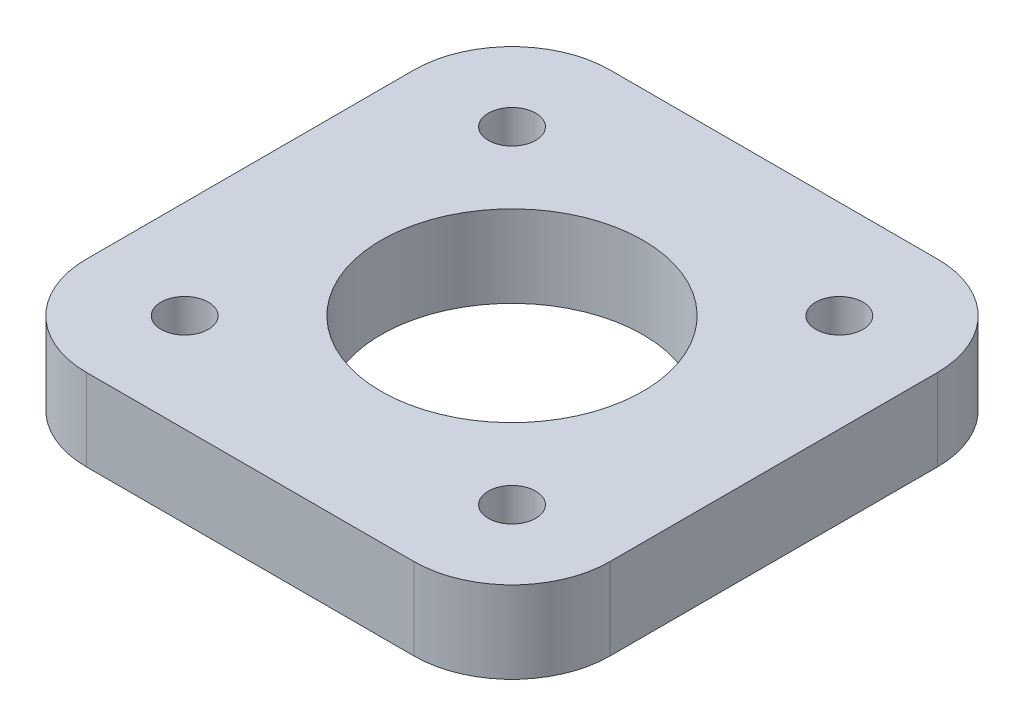
from build123d import *

# Parameters (mm, degrees)
SKETCH1_R           = 8
SKETCH1_R_2         = 1.445711851
BOSS_EXTRUDE1_DEPTH = 5


with BuildPart() as part:
    # Sketch1 → Boss-Extrude1 (new body)
    with BuildSketch(Plane(origin=(0, 0, 0), x_dir=(1, 0, 0), z_dir=(0, 1, 0))):
        with BuildLine():
            Line((-10, 16), (10, 16))
            ThreePointArc((10, 16), (14.242640687, 14.242640687), (16, 10))
            Line((16, 10), (16, -10))
            ThreePointArc((16, -10), (14.242640687, -14.242640687), (10, -16))
            Line((10, -16), (-10, -16))
            ThreePointArc((-10, -16), (-14.242640687, -14.242640687), (-16, -10))
            Line((-16, -10), (-16, 10))
            ThreePointArc((-16, 10), (-14.242640687, 14.242640687), (-10, 16))
        make_face()
        with Locations(Location((0, 0, 0), (0, 0, 270))):
            Circle(SKETCH1_R, mode=Mode.SUBTRACT)
        with Locations(Location((-10, 10, 0), (0, 0, 270))):
            Circle(SKETCH1_R_2, mode=Mode.SUBTRACT)
        with Locations(Location((10, 10, 0), (0, 0, 270))):
            Circle(SKETCH1_R_2, mode=Mode.SUBTRACT)
        with Locations(Location((10, -10, 0), (0, 0, 270))):
            Circle(SKETCH1_R_2, mode=Mode.SUBTRACT)
        with Locations(Location((-10, -10, 0), (0, 0, 270))):
            Circle(SKETCH1_R_2, mode=Mode.SUBTRACT)
    extrude(amount=-BOSS_EXTRUDE1_DEPTH)


solid = part.part
